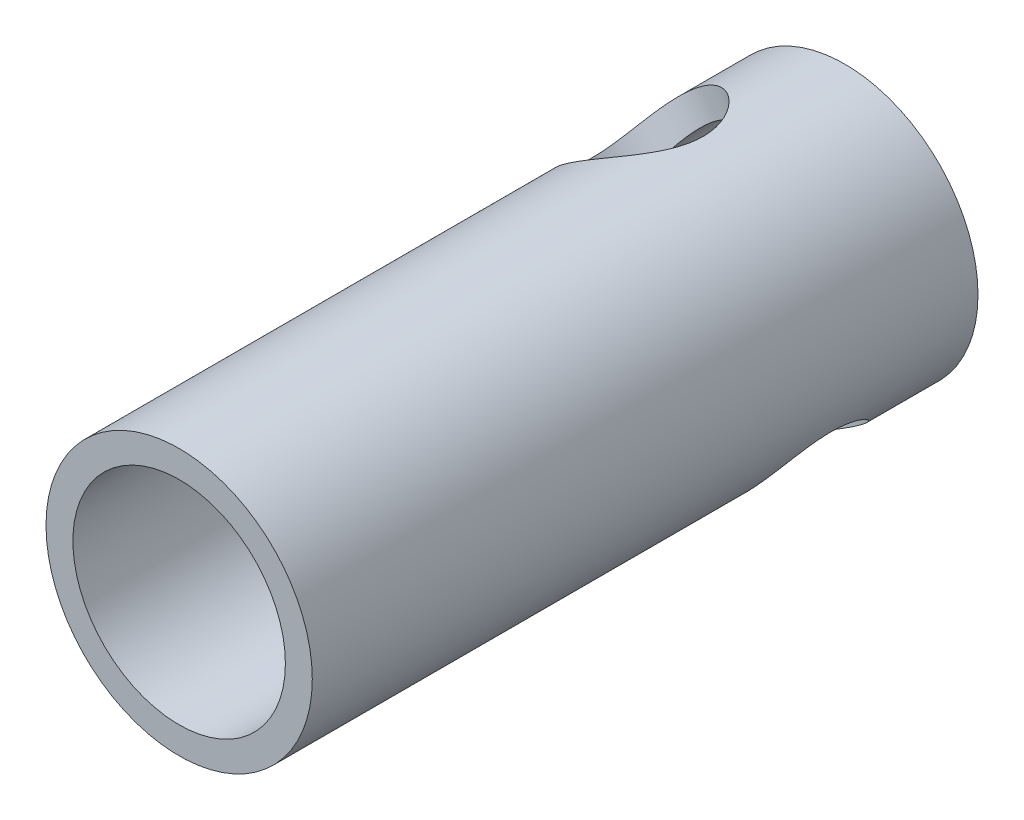
from build123d import *

# Parameters (mm, degrees)
CROQUIS1_R                 = 100
CROQUIS1_R_2               = 79.8
SALIENTE_EXTRUIR1_DEPTH    = 500
CORTAR_EXTRUIR1_DEPTH      = 586.09066571
CORTAR_EXTRUIR1_DEPTH_BACK = 586.09066571
CROQUIS2_R                 = 50


with BuildPart() as part:
    # Croquis1 → Saliente-Extruir1 (new body)
    with BuildSketch(Plane.XY):
        Circle(CROQUIS1_R)
        Circle(CROQUIS1_R_2, mode=Mode.SUBTRACT)
    extrude(amount=SALIENTE_EXTRUIR1_DEPTH)

    # Croquis2 → Cortar-Extruir1 (cut, two sides: drawn at the far end of the back side and taken through both)
    with BuildSketch(Plane(origin=(-136.394308599, -90.915735243, 0), x_dir=(0, 0, 1), z_dir=(-0.5538485277748214, 0.8326174441372599, 0)).offset(-CORTAR_EXTRUIR1_DEPTH_BACK)):
        with Locations(Location((100, 163.917826736, 0), (0, 0, 270))):
            Circle(CROQUIS2_R)
    extrude(amount=CORTAR_EXTRUIR1_DEPTH + CORTAR_EXTRUIR1_DEPTH_BACK, mode=Mode.SUBTRACT)


solid = part.part
